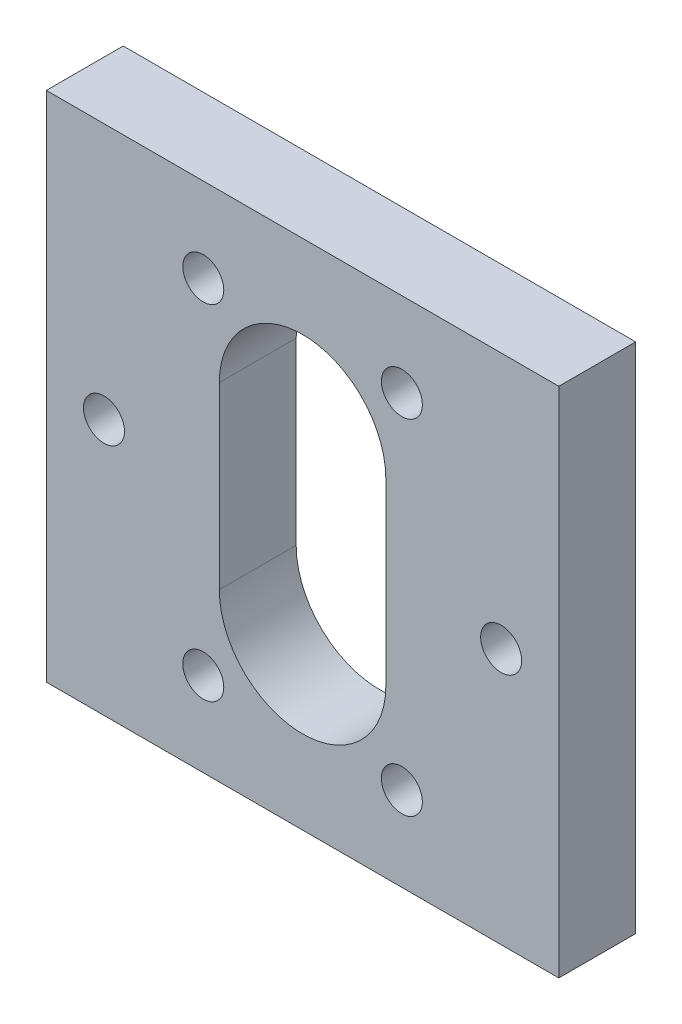
from build123d import *

# Parameters (mm, degrees)
SKETCH_1_W               = 40
SKETCH_1_H               = 40
EXTRUDE_1_DEPTH          = 6
CUT_EXTRUDE_1_DEPTH      = 29.91366459
CUT_EXTRUDE_1_DEPTH_BACK = 29.91366459
SKETCH_3_R               = 1.6
CUT_EXTRUDE_2_DEPTH      = 29.91366459


with BuildPart() as part:
    # 草圖1 → 填料-伸長1 (new body)
    with BuildSketch(Plane.XY):
        Rectangle(SKETCH_1_W, SKETCH_1_H)
    extrude(amount=EXTRUDE_1_DEPTH)

    # 草圖2 → 除料-伸長1 (cut, two sides: drawn at the far end of the back side and taken through both)
    with BuildSketch(Plane.XY.offset(6).offset(-CUT_EXTRUDE_1_DEPTH_BACK)):
        with BuildLine():
            Line((-6.5, -7), (-6.5, 7))
            ThreePointArc((-6.5, 7), (0, 13.5), (6.5, 7))
            Line((6.5, 7), (6.5, -7))
            ThreePointArc((6.5, -7), (0, -13.5), (-6.5, -7))
        make_face()
    extrude(amount=CUT_EXTRUDE_1_DEPTH + CUT_EXTRUDE_1_DEPTH_BACK, mode=Mode.SUBTRACT)

    # 草圖3 → 除料-伸長2 (cut, through all)
    with BuildSketch(Plane.XY.offset(6)):
        with Locations((-15.5, 0)):
            Circle(SKETCH_3_R)
        with Locations((-7.75, 13.423393759)):
            Circle(SKETCH_3_R)
        with Locations((7.75, 13.423393759)):
            Circle(SKETCH_3_R)
        with Locations((15.5, 0)):
            Circle(SKETCH_3_R)
        with Locations((7.75, -13.423393759)):
            Circle(SKETCH_3_R)
        with Locations((-7.75, -13.423393759)):
            Circle(SKETCH_3_R)
    extrude(amount=-CUT_EXTRUDE_2_DEPTH, mode=Mode.SUBTRACT)


solid = part.part
